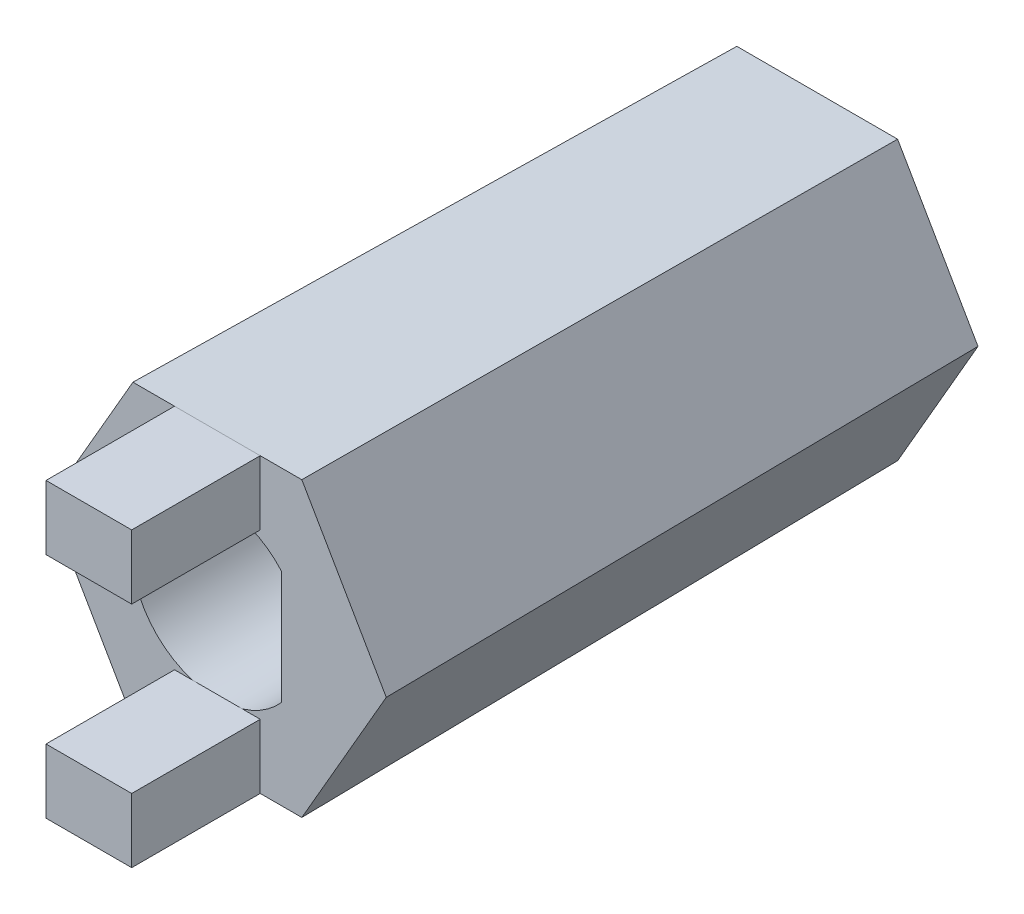
from build123d import *

# Parameters (mm, degrees)
EXTRUDE_1_DEPTH     = 14
EXTRUDE_1_DRAFT     = -0.67
CUT_EXTRUDE_1_DEPTH = 7
CUT_EXTRUDE_1_TAPER = 0.67
SKETCH_3_W          = 2
SKETCH_3_H          = 1.5
EXTRUDE_2_DEPTH     = 3


with BuildPart() as part:
    # 草图1 → 凸台-拉伸1 (with draft: the straight prism first)
    with BuildSketch(Plane.XY):
        Polygon((1.876388375, 3.25), (-1.876388375, 3.25), (-3.75277675, 0), (-1.876388375, -3.25), (1.876388375, -3.25), (3.75277675, 0), align=None)
    extrude(amount=EXTRUDE_1_DEPTH)
    # 凸台-拉伸1: the draft: its side faces are tilted about the plane it starts from
    extrude_1_sides = [part.faces().sort_by_distance(p)[0] for p in [
        (0, 3.25, 7),
        (-2.814582562, 1.625, 7),
        (-2.814582562, -1.625, 7),
        (0, -3.25, 7),
        (2.814582562, -1.625, 7),
        (2.814582562, 1.625, 7),
    ]]
    draft(extrude_1_sides, Plane.XY, EXTRUDE_1_DRAFT)

    # 草图2 → 切除-拉伸1 (cut)
    with BuildSketch(Plane.XY.offset(14)):
        with BuildLine():
            Line((1.5, -1.322875656), (1.5, 1.322875656))
            ThreePointArc((1.5, 1.322875656), (-2, 0), (1.5, -1.322875656))
        make_face()
    extrude(amount=-CUT_EXTRUDE_1_DEPTH, taper=CUT_EXTRUDE_1_TAPER, mode=Mode.SUBTRACT)

    # 草图3 → 凸台-拉伸2 (add)
    with BuildSketch(Plane.XY.offset(14)):
        with Locations((0, 2.663719346)):
            Rectangle(SKETCH_3_W, SKETCH_3_H)
        with Locations((0, -2.663719346)):
            Rectangle(SKETCH_3_W, SKETCH_3_H)
    extrude(amount=EXTRUDE_2_DEPTH)


solid = part.part
